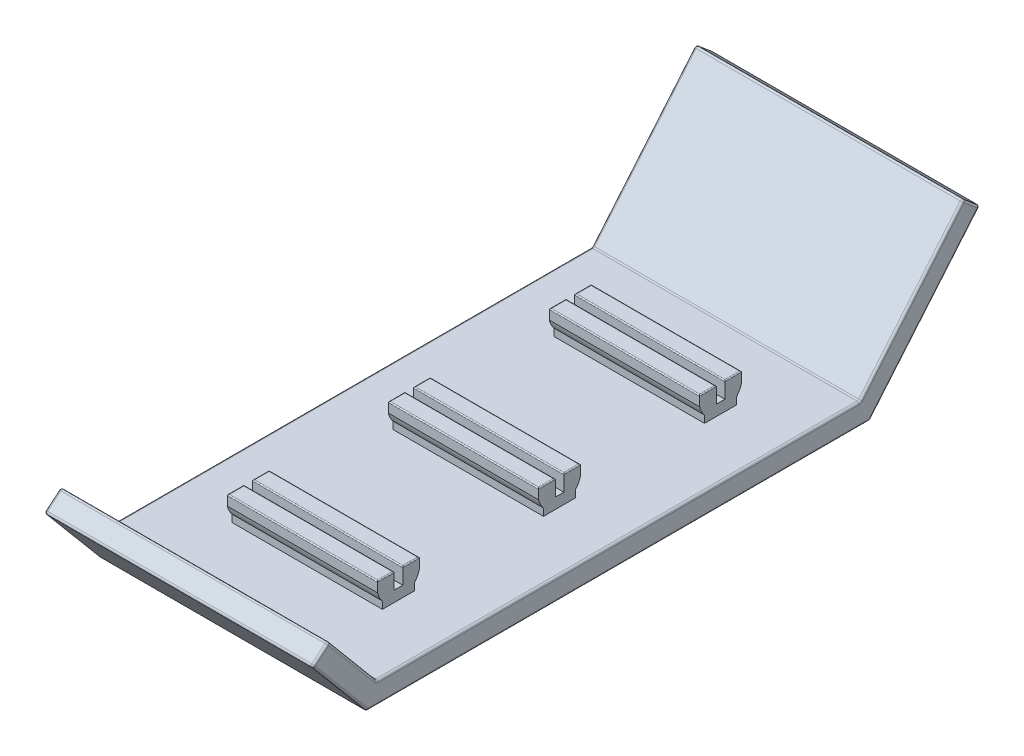
from build123d import *

# Parameters (mm, degrees)
EXTRUDE_1_DEPTH        = 25
EXTRUDE_START          = -5.5
EXTRUDE_2_DEPTH        = 14
PATTERN_LINEAR_1_COUNT = 3
PATTERN_LINEAR_1_PITCH = 15
FILLET_1_R             = 0.1
FILLET_2_R             = 0.2


with BuildPart() as part:
    # 草图1 → 凸台-拉伸1 (new body)
    with BuildSketch(Plane(origin=(0, 0, 0), x_dir=(0, 0, -1), z_dir=(1, 0, 0))):
        Polygon((0, 0), (-7.5, 0), (-11.999513268, 5.362311102), (-13.531602154, 4.076735882), (-8.432615316, -2), (0, -2), (38.432615316, -2), (48.673903032, 10.205091427), (47.141814145, 11.490666647), (37.5, 0), align=None)
    extrude(amount=EXTRUDE_1_DEPTH)

    # 草图2 → 凸台-拉伸2 (add)
    with BuildSketch(Plane(origin=(25, 0, 0), x_dir=(0, 0, -1), z_dir=(1, 0, 0)).offset(EXTRUDE_START)):
        with BuildLine():
            Line((1.5, 0), (-1.5, 0))
            Line((-1.5, 0), (-1.5, 0.677124344))
            ThreePointArc((-1.5, 0.677124344), (-1.780042303, 1.088161527), (-1.95, 1.555590279))
            Line((-1.95, 1.555590279), (-1.95, 2.5))
            Line((-1.95, 2.5), (-0.4, 2.5))
            Line((-0.4, 2.5), (-0.4, 1))
            Line((-0.4, 1), (0.4, 1))
            Line((0.4, 1), (0.4, 2.5))
            Line((0.4, 2.5), (1.95, 2.5))
            Line((1.95, 2.5), (1.95, 1.555590279))
            ThreePointArc((1.95, 1.555590279), (1.780042303, 1.088161527), (1.5, 0.677124344))
            Line((1.5, 0.677124344), (1.5, 0))
        make_face()
    extrude_2 = extrude(amount=-EXTRUDE_2_DEPTH)

    # 阵列(线性)1: 凸台-拉伸2 ×3
    with Locations(*[(0, 0, -i * PATTERN_LINEAR_1_PITCH) for i in range(1, PATTERN_LINEAR_1_COUNT)]):
        add(extrude_2)

    # 圆角1
    fillet_1_edges = [part.edges().sort_by_distance(p)[0] for p in [
        (12.5, 2.5, 0.4),
        (5.5, 2.5, -1.175),
        (12.5, 2.5, -0.4),
        (12.5, 2.5, -1.95),
        (5.5, 2.5, 1.175),
        (12.5, 2.5, 1.95),
        (19.5, 2.5, 1.175),
        (19.5, 2.5, -1.175),
        (12.5, 2.5, -14.6),
        (5.5, 2.5, -16.175),
        (12.5, 2.5, -15.4),
        (12.5, 2.5, -16.95),
        (5.5, 2.5, -13.825),
        (12.5, 2.5, -13.05),
        (19.5, 2.5, -13.825),
        (19.5, 2.5, -16.175),
        (12.5, 2.5, -29.6),
        (5.5, 2.5, -31.175),
        (12.5, 2.5, -30.4),
        (12.5, 2.5, -31.95),
        (5.5, 2.5, -28.825),
        (12.5, 2.5, -28.05),
        (19.5, 2.5, -28.825),
        (19.5, 2.5, -31.175),
    ]]
    fillet(fillet_1_edges, radius=FILLET_1_R)

    # 圆角2
    fillet_2_edges = [part.edges().sort_by_distance(p)[0] for p in [
        (25, 2.681155551, 9.749756634),
        (0, 4.102545714, -43.553259174),
        (0, -2, -15),
        (0, 1.038367941, 10.982108735),
        (0, 4.719523492, 12.765557711),
        (0, 2.681155551, 9.749756634),
        (0, 0, -15),
        (25, 4.719523492, 12.765557711),
        (25, 1.038367941, 10.982108735),
        (12.5, 0, -37.5),
        (12.5, 11.490666647, -47.141814145),
        (12.5, 10.205091427, -48.673903032),
        (12.5, -2, -38.432615316),
        (12.5, -2, 8.432615316),
        (12.5, 4.076735882, 13.531602154),
        (12.5, 5.362311102, 11.999513268),
        (12.5, 0, 7.5),
        (25, -2, -15),
        (25, 4.102545714, -43.553259174),
        (25, 10.847879037, -47.907858588),
        (25, 5.745333323, -42.320907073),
        (25, 0, -15),
        (0, 5.745333323, -42.320907073),
        (0, 10.847879037, -47.907858588),
    ]]
    fillet(fillet_2_edges, radius=FILLET_2_R)


solid = part.part
